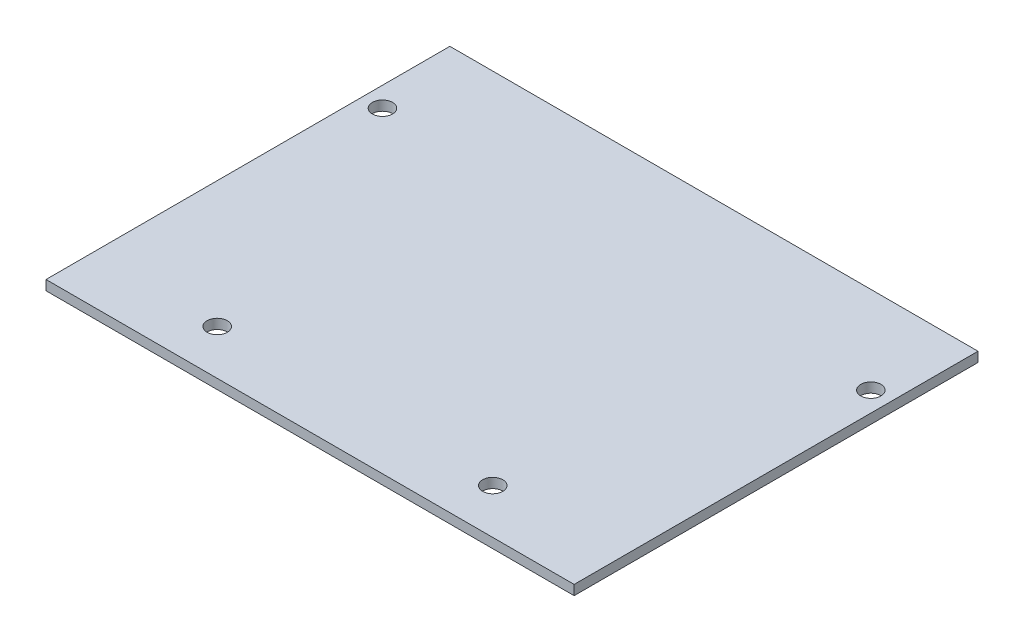
from build123d import *

# Parameters (mm, degrees)
SKETCH1_W           = 86.36
SKETCH1_H           = 66.04
SKETCH1_R           = 1.65
BOSS_EXTRUDE1_DEPTH = 1.6


with BuildPart() as part:
    # Sketch1 → Boss-Extrude1 (new body)
    with BuildSketch(Plane(origin=(0, 0, 0), x_dir=(1, 0, 0), z_dir=(0, 1, 0))):
        Rectangle(SKETCH1_W, SKETCH1_H)
        with Locations(Location((-22.5298, -25.6794, 0), (0, 0, 270))):
            Circle(SKETCH1_R, mode=Mode.SUBTRACT)
        with Locations(Location((-39.9288, 18.7452, 0), (0, 0, 270))):
            Circle(SKETCH1_R, mode=Mode.SUBTRACT)
        with Locations(Location((39.9288, 18.7452, 0), (0, 0, 90))):
            Circle(SKETCH1_R, mode=Mode.SUBTRACT)
        with Locations(Location((22.5298, -25.6794, 0), (0, 0, 90))):
            Circle(SKETCH1_R, mode=Mode.SUBTRACT)
    extrude(amount=BOSS_EXTRUDE1_DEPTH)


solid = part.part
